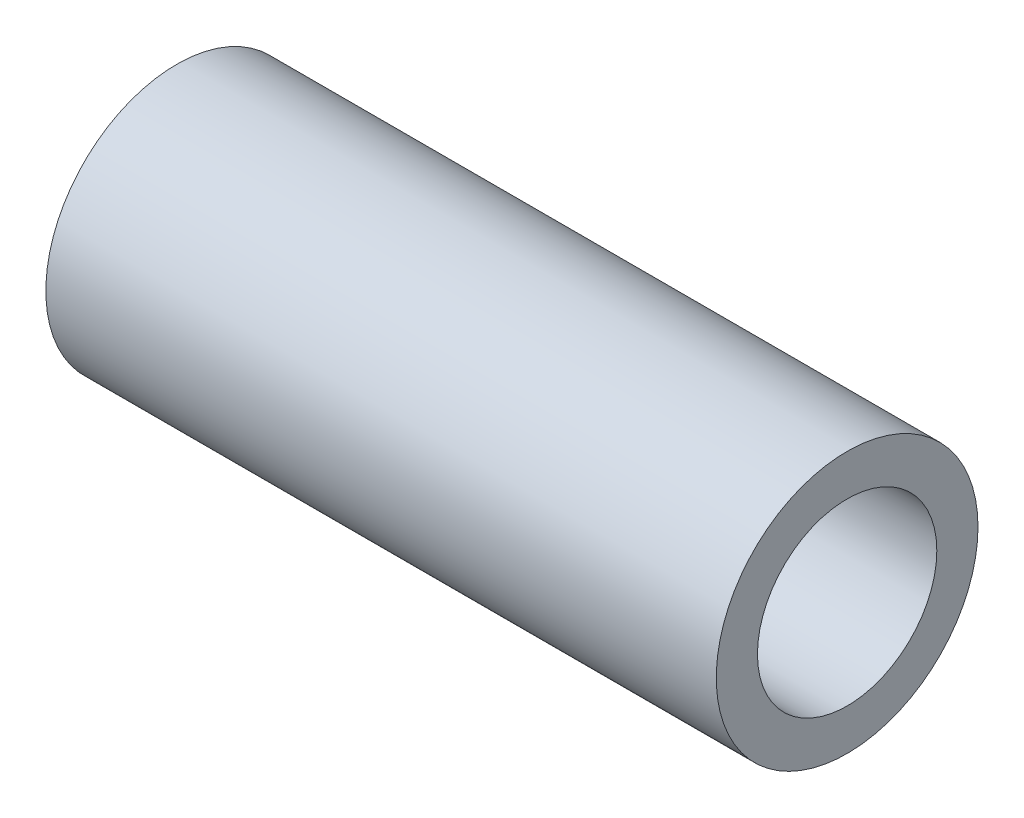
from build123d import *

# Parameters (mm, degrees)
SKETCH1_R           = 4.7625
SKETCH1_R_2         = 3.2639
BOSS_EXTRUDE1_DEPTH = 24.3967


with BuildPart() as part:
    # Sketch1 → Boss-Extrude1 (new body)
    with BuildSketch(Plane(origin=(0, 0, 0), x_dir=(0, 0, -1), z_dir=(1, 0, 0))):
        Circle(SKETCH1_R)
        Circle(SKETCH1_R_2, mode=Mode.SUBTRACT)
    extrude(amount=BOSS_EXTRUDE1_DEPTH)


solid = part.part
